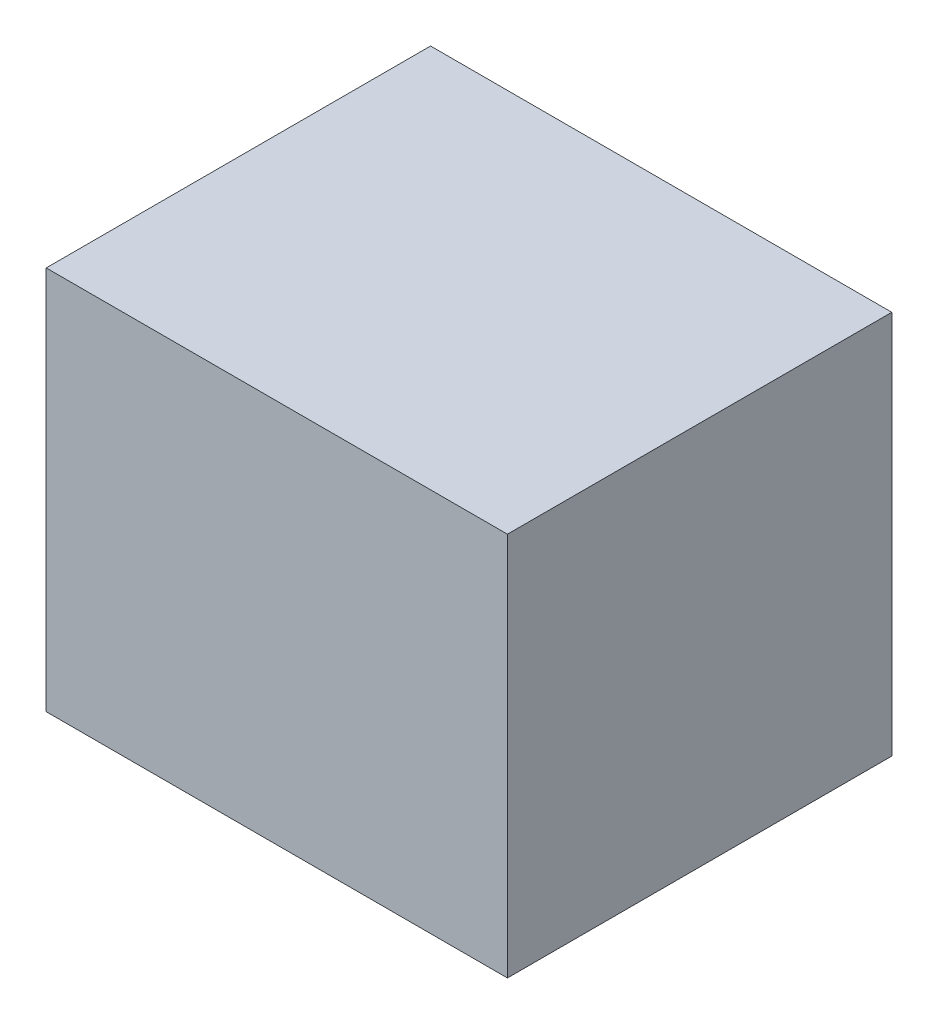
from build123d import *

# Parameters (mm, degrees)
SKETCH1_W           = 600
SKETCH1_H           = 500
BOSS_EXTRUDE1_DEPTH = 500


with BuildPart() as part:
    # Sketch1 → Boss-Extrude1 (new body)
    with BuildSketch(Plane.XY):
        with Locations((300, 250)):
            Rectangle(SKETCH1_W, SKETCH1_H)
    extrude(amount=BOSS_EXTRUDE1_DEPTH)


solid = part.part
